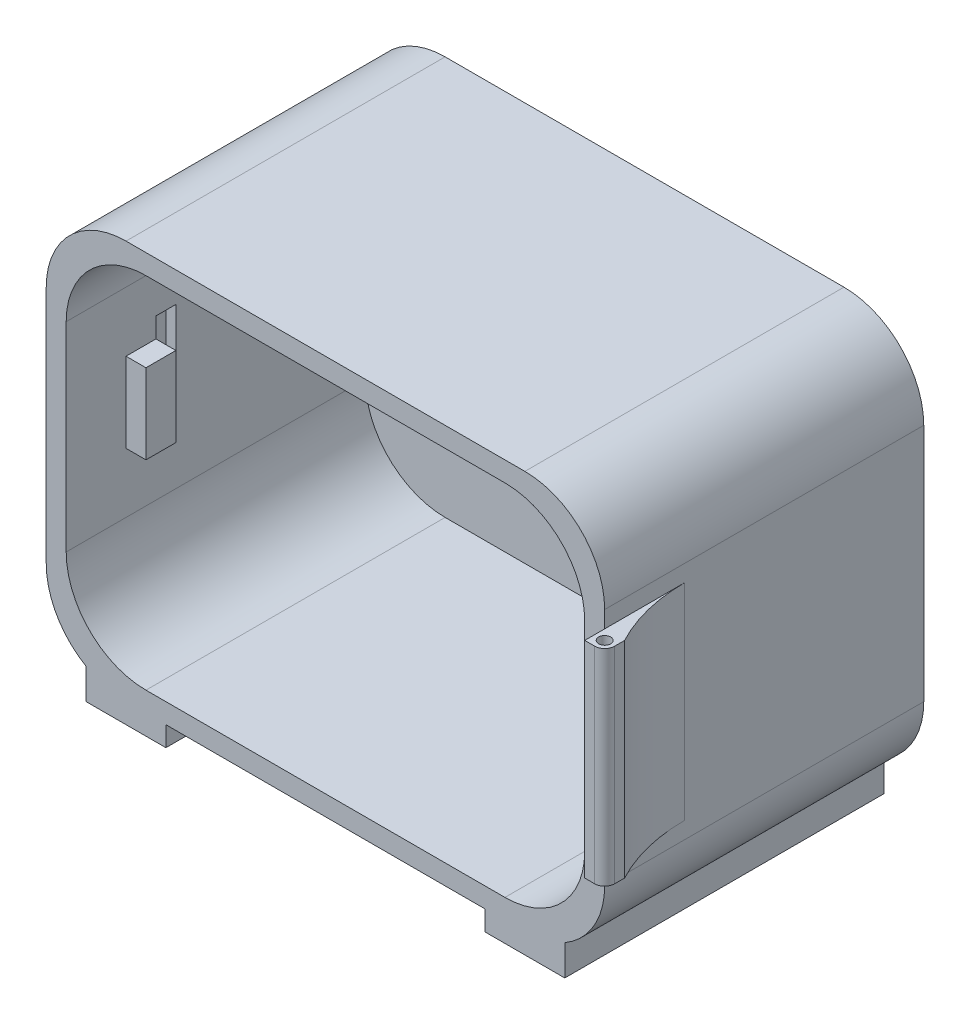
from build123d import *

# Parameters (mm, degrees)
BOSS_EXTRUDE1_DEPTH             = 95.25
BOSS_EXTRUDE2_DEPTH             = 6.35
SKETCH4_W                       = 25.4
SKETCH4_H                       = 101.6
BOSS_EXTRUDE3_DEPTH             = 6.35
BOSS_EXTRUDE3_DIRECTION_2_REACH = 187.35
BOSS_EXTRUDE5_DEPTH             = 32.766
BOSS_EXTRUDE5_DEPTH_BACK        = 32.766
SKETCH5_R                       = 1.905
FILLET1_R                       = 3.175
SKETCH8_W                       = 6.35
SKETCH8_H                       = 38.1
CUT_EXTRUDE1_DEPTH              = 3.175
SKETCH10_W                      = 9.525
SKETCH10_H                      = 25.4
BOSS_EXTRUDE6_DEPTH             = 6.35
SKETCH11_R                      = 44.824096384
CUT_EXTRUDE4_DEPTH              = 1.5875
SKETCH12_W                      = 1.13974359
SKETCH12_H                      = 13.025641026
SKETCH12_W_2                    = 4.884615385
SKETCH12_H_2                    = 1.302564103
CUT_EXTRUDE5_DEPTH              = 1.5875


with BuildPart() as part:
    # Sketch1 → Boss-Extrude1 (new body)
    with BuildSketch(Plane.XY):
        with BuildLine():
            Line((-63.5, 63.5), (63.5, 63.5))
            ThreePointArc((63.5, 63.5), (81.460512242, 56.060512242), (88.9, 38.1))
            Line((88.9, 38.1), (88.9, -38.1))
            ThreePointArc((88.9, -38.1), (81.460512242, -56.060512242), (63.5, -63.5))
            Line((63.5, -63.5), (-63.5, -63.5))
            ThreePointArc((-63.5, -63.5), (-81.460512242, -56.060512242), (-88.9, -38.1))
            Line((-88.9, -38.1), (-88.9, 38.1))
            ThreePointArc((-88.9, 38.1), (-81.460512242, 56.060512242), (-63.5, 63.5))
        make_face()
        with BuildLine():
            Line((-82.55, 31.75), (-82.55, -31.75))
            ThreePointArc((-82.55, -31.75), (-75.110512242, -49.710512242), (-57.15, -57.15))
            Line((-57.15, -57.15), (57.15, -57.15))
            ThreePointArc((57.15, -57.15), (75.110512242, -49.710512242), (82.55, -31.75))
            Line((82.55, -31.75), (82.55, 31.75))
            ThreePointArc((82.55, 31.75), (75.110512242, 49.710512242), (57.15, 57.15))
            Line((57.15, 57.15), (-57.15, 57.15))
            ThreePointArc((-57.15, 57.15), (-75.110512242, 49.710512242), (-82.55, 31.75))
        make_face(mode=Mode.SUBTRACT)
    extrude(amount=-BOSS_EXTRUDE1_DEPTH)

    # Sketch2 → Boss-Extrude2 (add)
    with BuildSketch(Plane(origin=(0, 0, -95.25), x_dir=(-1, 0, 0), z_dir=(0, 0, -1))):
        with BuildLine():
            Line((-63.5, 63.5), (63.5, 63.5))
            ThreePointArc((63.5, 63.5), (81.460512242, 56.060512242), (88.9, 38.1))
            Line((88.9, 38.1), (88.9, -38.1))
            ThreePointArc((88.9, -38.1), (81.460512242, -56.060512242), (63.5, -63.5))
            Line((63.5, -63.5), (-63.5, -63.5))
            ThreePointArc((-63.5, -63.5), (-81.460512242, -56.060512242), (-88.9, -38.1))
            Line((-88.9, -38.1), (-88.9, 38.1))
            ThreePointArc((-88.9, 38.1), (-81.460512242, 56.060512242), (-63.5, 63.5))
        make_face()
    extrude(amount=BOSS_EXTRUDE2_DEPTH)

    # Sketch4 → Boss-Extrude3 (add)
    with BuildSketch(Plane.XZ.offset(63.5)):
        with Locations((-63.5, -50.8)):
            Rectangle(SKETCH4_W, SKETCH4_H)
        with Locations((63.5, -50.8)):
            Rectangle(SKETCH4_W, SKETCH4_H)
    extrude(amount=BOSS_EXTRUDE3_DEPTH)

    # Sketch4 → Boss-Extrude3 direction 2 (add, up to next)
    with BuildSketch(Plane.XZ.offset(63.5), mode=Mode.PRIVATE) as boss_extrude3_direction_2_sk1:
        with Locations((-63.5, -50.8)):
            Rectangle(SKETCH4_W, SKETCH4_H)
    boss_extrude3_direction_2_tool1 = extrude(boss_extrude3_direction_2_sk1.sketch, amount=-BOSS_EXTRUDE3_DIRECTION_2_REACH, mode=Mode.PRIVATE) - part.part
    # Sketch4 → Boss-Extrude3 direction 2 (add, up to next)
    with BuildSketch(Plane.XZ.offset(63.5), mode=Mode.PRIVATE) as boss_extrude3_direction_2_sk2:
        with Locations((63.5, -50.8)):
            Rectangle(SKETCH4_W, SKETCH4_H)
    boss_extrude3_direction_2_tool2 = extrude(boss_extrude3_direction_2_sk2.sketch, amount=-BOSS_EXTRUDE3_DIRECTION_2_REACH, mode=Mode.PRIVATE) - part.part
    add(boss_extrude3_direction_2_tool1.solids().sort_by_distance((-63.5, -63.5, -50.8))[0])
    add(boss_extrude3_direction_2_tool2.solids().sort_by_distance((63.5, -63.5, -50.8))[0])

    # Sketch5 → Boss-Extrude5 (add, two sides: drawn at the far end of the back side and taken through both)
    with BuildSketch(Plane(origin=(0, 0, 0), x_dir=(1, 0, 0), z_dir=(0, 1, 0)).offset(-BOSS_EXTRUDE5_DEPTH_BACK)):
        with BuildLine():
            Line((88.9, 25.4), (88.9, 0))
            Line((88.9, 0), (88.9, -6.35))
            Line((88.9, -6.35), (95.25, -6.35))
            Line((95.25, -6.35), (95.25, 0))
            ThreePointArc((95.25, 0), (90.511558555, 12.309139639), (88.9, 25.4))
        make_face()
        with Locations(Location((92.075, -3.175, 0), (0, 0, 270))):
            Circle(SKETCH5_R, mode=Mode.SUBTRACT)
    extrude(amount=BOSS_EXTRUDE5_DEPTH + BOSS_EXTRUDE5_DEPTH_BACK)

    # Fillet1
    fillet1_edges = [part.edges().sort_by_distance(p)[0] for p in [
        (95.25, 0, 6.35),
    ]]
    fillet(fillet1_edges, radius=FILLET1_R)

    # Sketch8 → Cut-Extrude1 (cut)
    with BuildSketch(Plane(origin=(-82.55, 0, 0), x_dir=(0, 0, -1), z_dir=(1, 0, 0))):
        with Locations((31.75, 0)):
            Rectangle(SKETCH8_W, SKETCH8_H)
    extrude(amount=-CUT_EXTRUDE1_DEPTH, mode=Mode.SUBTRACT)

    # Sketch10 → Boss-Extrude6 (add)
    with BuildSketch(Plane(origin=(-82.55, 0, 0), x_dir=(0, 0, -1), z_dir=(1, 0, 0))):
        with Locations((23.8125, 0)):
            Rectangle(SKETCH10_W, SKETCH10_H)
    extrude(amount=BOSS_EXTRUDE6_DEPTH)

    # Sketch11 → Cut-Extrude4 (cut)
    # profile 1 of 2: a face of its own
    with BuildSketch(Plane(origin=(0, 0, -101.6), x_dir=(-1, 0, 0), z_dir=(0, 0, -1))):
        with Locations((0, 3.175)):
            Circle(SKETCH11_R)
        with BuildLine():
            Line((-8.558023622, 38.277554278), (9.414722671, 38.277554278))
            Line((9.414722671, 38.277554278), (12.376141094, 30.516595652))
            Line((12.376141094, 30.516595652), (6.555422124, 30.516595652))
            ThreePointArc((6.555422124, 30.516595652), (-1.070912861, 28.84594719), (6.555422124, 27.175298727))
            Line((6.555422124, 27.175298727), (13.309498487, 27.175298727))
            Line((13.309498487, 27.175298727), (31.249567059, -24.733260338))
            Line((31.249567059, -24.733260338), (24.338229167, -24.733260338))
            Line((24.338229167, -24.733260338), (24.338229167, -18.851270642))
            ThreePointArc((24.338229167, -18.851270642), (22.794206871, -11.23122082), (21.250184576, -18.851270642))
            Line((21.250184576, -18.851270642), (21.250184576, -24.733260338))
            Line((21.250184576, -24.733260338), (16.103443592, -24.733260338))
            Line((16.103443592, -24.733260338), (16.103443592, -18.851270642))
            ThreePointArc((16.103443592, -18.851270642), (14.239792343, -11.126064356), (12.376141094, -18.851270642))
            Line((12.376141094, -18.851270642), (12.376141094, -24.733260338))
            Line((12.376141094, -24.733260338), (10.515553381, -24.733260338))
            Line((10.515553381, -24.733260338), (8.456856988, -17.527822961))
            Line((8.456856988, -17.527822961), (-7.424515191, -17.527822961))
            Line((-7.424515191, -17.527822961), (-9.630261327, -24.733260338))
            Line((-9.630261327, -24.733260338), (-30.070175519, -24.733260338))
            Line((-30.070175519, -24.733260338), (-27.864429383, -17.527822961))
            Line((-27.864429383, -17.527822961), (-20.953091491, -17.527822961))
            ThreePointArc((-20.953091491, -17.527822961), (-12.798886715, -15.836750923), (-20.953091491, -14.145678885))
            Line((-20.953091491, -14.145678885), (-26.540981702, -14.145678885))
            Line((-26.540981702, -14.145678885), (-8.558023622, 38.277554278))
        make_face(mode=Mode.SUBTRACT)
    # profile 2 of 2: a face of its own
    with BuildSketch(Plane(origin=(0, 0, -101.6), x_dir=(-1, 0, 0), z_dir=(0, 0, -1))):
        Polygon((0.754840192, 15.029545848), (-4.852280703, -6.689071297), (6.018431459, -6.689071297), align=None)
    extrude(amount=-CUT_EXTRUDE4_DEPTH, mode=Mode.SUBTRACT)

    # Sketch12 → Cut-Extrude5 (cut)
    # profile 1 of 11: a face of its own
    with BuildSketch(Plane(origin=(0, 0, -101.6), x_dir=(-1, 0, 0), z_dir=(0, 0, -1))):
        with BuildLine():
            Line((51.288461538, -47.869230769), (52.428205128, -47.869230769))
            Line((52.428205128, -47.869230769), (52.428205128, -55.234314904))
            add(Edge.make_bspline(
                [(52.428205128, -55.234314904), (52.427199859, -55.391205604), (52.425259449, -55.694042448), (52.411285924, -56.131932206), (52.381819467, -56.536394859), (52.348405109, -56.909275054), (52.300338453, -57.248844425), (52.241641349, -57.556116225), (52.175471884, -57.831385323), (52.117341381, -58.000929746), (52.08984375, -58.081129808)],
                knots=[0, 0, 0, 0, 1.307562039, 2.523909702, 3.650326591, 4.686913197, 5.643429486, 6.506965704, 7.293745905, 8, 8, 8, 8], degree=3))
            add(Edge.make_bspline(
                [(52.08984375, -58.081129808), (52.049242798, -58.18537838), (51.969254836, -58.39075856), (51.819446966, -58.681894524), (51.651683945, -58.956019996), (51.460070878, -59.211607319), (51.245474246, -59.44737343), (51.012949975, -59.668440513), (50.757969566, -59.870131635), (50.48067881, -60.048966857), (50.187469798, -60.210028454), (49.878511085, -60.349534569), (49.555544866, -60.471043973), (49.215537231, -60.562058689), (48.863818951, -60.640924675), (48.496253987, -60.692249677), (48.114989839, -60.727182146), (47.855745174, -60.730412419), (47.72421875, -60.732051282)],
                knots=[0, 0, 0, 0, 0.981931301, 1.934503488, 2.87077864, 3.801706999, 4.735015492, 5.667491629, 6.616593066, 7.585388521, 8.561939025, 9.551802639, 10.560317337, 11.588439944, 12.640189604, 13.723962949, 14.845264515, 16, 16, 16, 16], degree=3))
            add(Edge.make_bspline(
                [(47.72421875, -60.732051282), (47.532322713, -60.728943462), (47.157498196, -60.722873055), (46.611017223, -60.652148877), (46.092005525, -60.552165866), (45.607321067, -60.400834743), (45.160026716, -60.21564338), (44.753177225, -60.003027408), (44.39042492, -59.759226202), (44.063404735, -59.481638307), (43.768250965, -59.151570091), (43.490566228, -58.762591428), (43.223282238, -58.308777287), (43.066641753, -57.975700871), (42.984615385, -57.801282051)],
                knots=[0, 0, 0, 0, 1.157897085, 2.2616841, 3.32207898, 4.345638746, 5.321241055, 6.241986252, 7.112515963, 7.955008012, 8.825025602, 9.77857164, 10.836726669, 12, 12, 12, 12], degree=3))
            Line((42.984615385, -57.801282051), (44.124358974, -57.801282051))
            add(Edge.make_bspline(
                [(44.124358974, -57.801282051), (44.216024705, -57.946809086), (44.395219921, -58.231296519), (44.730312981, -58.599644257), (45.097547365, -58.914435037), (45.509316501, -59.168111274), (45.967333711, -59.359372517), (46.471874544, -59.495717165), (47.0270446, -59.577346476), (47.413553549, -59.5871846), (47.614823718, -59.592307692)],
                knots=[0, 0, 0, 0, 0.997731894, 1.950442991, 2.880492273, 3.800895997, 4.748200782, 5.754801363, 6.83083817, 8, 8, 8, 8], degree=3))
            add(Edge.make_bspline(
                [(47.614823718, -59.592307692), (47.813549291, -59.587118295), (48.196672306, -59.577113657), (48.747602548, -59.495680734), (49.25050418, -59.359342846), (49.702479765, -59.168449559), (50.098196411, -58.934586655), (50.439325637, -58.673329242), (50.715622033, -58.378758174), (50.90145194, -58.107407049), (51.016966124, -57.865656635), (51.090525383, -57.657548644), (51.150302358, -57.422225345), (51.200303483, -57.160475674), (51.241563654, -56.871925661), (51.267699828, -56.55591554), (51.286589487, -56.213163505), (51.287823092, -55.975516975), (51.288461538, -55.852524038)],
                knots=[0, 0, 0, 0, 1.570740765, 3.028230971, 4.391408896, 5.680370741, 6.894727393, 8.017376726, 9.065722033, 10.075533815, 10.603371122, 11.180248986, 11.817768598, 12.521299649, 13.286540596, 14.121245857, 15.027658897, 16, 16, 16, 16], degree=3))
            Line((51.288461538, -55.852524038), (51.288461538, -55.371694712))
            add(Edge.make_bspline(
                [(51.288461538, -55.371694712), (51.172778627, -55.509369251), (50.94344763, -55.782296676), (50.547398758, -56.139934615), (50.114811664, -56.447950002), (49.64642281, -56.70056619), (49.153705474, -56.902610217), (48.641996238, -57.043917532), (48.115882209, -57.135212026), (47.759367265, -57.145035716), (47.579206731, -57.15)],
                knots=[0, 0, 0, 0, 1.012485704, 2.007162095, 2.997754123, 3.998611389, 4.999708251, 5.992315798, 6.98544096, 8, 8, 8, 8], degree=3))
            add(Edge.make_bspline(
                [(47.579206731, -57.15), (47.473120839, -57.14813119), (47.262204473, -57.144415684), (46.948860104, -57.111908121), (46.640139657, -57.064741256), (46.336763132, -56.995502891), (46.038292765, -56.906632912), (45.745221788, -56.795537889), (45.455177277, -56.66993446), (45.173431413, -56.52198743), (44.90279031, -56.357387059), (44.645295324, -56.179083085), (44.402295197, -55.988008724), (44.176102792, -55.782279829), (43.967014813, -55.562194153), (43.772219063, -55.330097832), (43.594936689, -55.082749942), (43.43152982, -54.824660696), (43.289806709, -54.554111058), (43.165403416, -54.276967683), (43.057237861, -53.993823162), (42.971003403, -53.703729535), (42.905140792, -53.406869688), (42.856117969, -53.103729945), (42.828312474, -52.793376824), (42.823976607, -52.584293643), (42.821794872, -52.479086538)],
                knots=[0, 0, 0, 0, 1.028754217, 2.045334182, 3.052854819, 4.056607503, 5.061168794, 6.071104265, 7.095078842, 8.125279047, 9.155117945, 10.165957491, 11.161587969, 12.151493252, 13.128948131, 14.104219989, 15.088194871, 16.07871515, 17.064853787, 18.047899887, 19.02414258, 20.002704429, 20.980574569, 21.971845993, 22.979467364, 24, 24, 24, 24], degree=3))
            add(Edge.make_bspline(
                [(42.821794872, -52.479086538), (42.823678704, -52.373846733), (42.827439071, -52.163774731), (42.859918339, -51.852155247), (42.906248626, -51.544708439), (42.97957396, -51.244603296), (43.06782997, -50.948422054), (43.177135505, -50.658352398), (43.30855786, -50.374305979), (43.457364666, -50.096072451), (43.624584088, -49.827385391), (43.807944804, -49.572200133), (44.007668176, -49.332394481), (44.220998841, -49.105549178), (44.450541606, -48.893852903), (44.696177721, -48.697819459), (44.955485887, -48.514162849), (45.229269765, -48.346844569), (45.513304861, -48.198863274), (45.800375, -48.063834708), (46.094282881, -47.956668046), (46.389548953, -47.862241372), (46.691373215, -47.79534795), (46.9960549, -47.743741529), (47.304637097, -47.71230097), (47.511294745, -47.708376362), (47.614823718, -47.706410256)],
                knots=[0, 0, 0, 0, 1.008818848, 2.013730394, 3.001654427, 3.987803273, 4.973046549, 5.963777569, 6.957074694, 7.972068341, 8.987420212, 9.989399531, 10.982630087, 11.977756091, 12.973280677, 13.973972381, 14.989194003, 16.018387222, 17.047741039, 18.059210846, 19.057554164, 20.045176975, 21.029480261, 22.018708529, 23.007435371, 24, 24, 24, 24], degree=3))
            add(Edge.make_bspline(
                [(47.614823718, -47.706410256), (47.785551411, -47.711333042), (48.122686145, -47.721054032), (48.618824354, -47.797330759), (49.097586196, -47.918938751), (49.561673282, -48.093166896), (50.014866073, -48.331019892), (50.455670936, -48.644321446), (50.885363223, -49.035881822), (51.150531351, -49.336156501), (51.288461538, -49.492347756)],
                knots=[0, 0, 0, 0, 0.96728863, 1.910097829, 2.838038873, 3.762875196, 4.71315279, 5.730631239, 6.819562287, 8, 8, 8, 8], degree=3))
            Line((51.288461538, -49.492347756), (51.288461538, -47.869230769))
        make_face()
        with BuildLine():
            add(Edge.make_bspline(
                [(47.706410256, -48.846153846), (47.539747417, -48.851818284), (47.209790334, -48.863032669), (46.726144062, -48.958771486), (46.259230618, -49.108798037), (45.817976636, -49.323401242), (45.404656551, -49.585000334), (45.037899346, -49.901920806), (44.717115793, -50.263857006), (44.44576056, -50.667536474), (44.229746744, -51.103045873), (44.076826336, -51.562099108), (43.97794768, -52.037278654), (43.9670342, -52.361573528), (43.961538462, -52.524879808)],
                knots=[0, 0, 0, 0, 1.026226791, 2.031711442, 3.026614839, 4.04107745, 5.047145931, 6.032893242, 7.017642609, 8.019221815, 9.021877557, 10.003543541, 10.994637589, 12, 12, 12, 12], degree=3))
            add(Edge.make_bspline(
                [(43.961538462, -52.524879808), (43.964171922, -52.648009111), (43.969351169, -52.890168444), (44.019148151, -53.24554309), (44.099633367, -53.584017371), (44.213705516, -53.905611758), (44.355048152, -54.212170871), (44.532820469, -54.501582952), (44.742011138, -54.774105742), (44.980982821, -55.027723588), (45.244331407, -55.258721959), (45.529969644, -55.461697135), (45.837510122, -55.627706894), (46.159389119, -55.771183647), (46.503416719, -55.875973408), (46.864637689, -55.955942692), (47.245607559, -56.001694469), (47.505310727, -56.007365193), (47.637720353, -56.01025641)],
                knots=[0, 0, 0, 0, 1.039728707, 2.044842319, 3.024901384, 3.974314358, 4.923051295, 5.871625912, 6.837440708, 7.820715446, 8.810779094, 9.792721783, 10.773906224, 11.758876063, 12.764959493, 13.806266761, 14.881525401, 16, 16, 16, 16], degree=3))
            add(Edge.make_bspline(
                [(47.637720353, -56.01025641), (47.771845989, -56.007471086), (48.034127251, -56.002024414), (48.417198935, -55.955203148), (48.780174878, -55.87964912), (49.122722262, -55.772377571), (49.446134443, -55.635501504), (49.74677833, -55.462285778), (50.031100299, -55.265020553), (50.290022128, -55.03492553), (50.524152671, -54.781342834), (50.728190025, -54.5054085), (50.902051026, -54.211274617), (51.046024285, -53.898974339), (51.155938083, -53.566080658), (51.229666681, -53.213425767), (51.281216871, -52.8426992), (51.286009941, -52.588667936), (51.288461538, -52.458733974)],
                knots=[0, 0, 0, 0, 1.121943988, 2.193949579, 3.223793937, 4.220241907, 5.192961521, 6.155822191, 7.11847367, 8.083710714, 9.04790392, 10.001595906, 10.949595423, 11.902125208, 12.873731292, 13.87582262, 14.913508608, 16, 16, 16, 16], degree=3))
            add(Edge.make_bspline(
                [(51.288461538, -52.458733974), (51.28360082, -52.289577761), (51.274104683, -51.959105963), (51.184489283, -51.477569977), (51.039998806, -51.024837932), (50.837354876, -50.602341676), (50.583420159, -50.214557882), (50.277564793, -49.868668503), (49.925063482, -49.564228252), (49.526929004, -49.310597664), (49.098585417, -49.105708802), (48.650379935, -48.951996086), (48.182977974, -48.864931), (47.866180431, -48.85244892), (47.706410256, -48.846153846)],
                knots=[0, 0, 0, 0, 1.070913519, 2.092188694, 3.091357305, 4.074328408, 5.051968682, 6.018948707, 6.99050112, 7.9935919, 9.000589572, 9.992915277, 10.987769056, 12, 12, 12, 12], degree=3))
        make_face(mode=Mode.SUBTRACT)
    # profile 2 of 11: a face of its own
    with BuildSketch(Plane(origin=(0, 0, -101.6), x_dir=(-1, 0, 0), z_dir=(0, 0, -1))):
        with BuildLine():
            Line((37.611538462, -47.869230769), (38.751282051, -47.869230769))
            Line((38.751282051, -47.869230769), (38.751282051, -49.235396635))
            add(Edge.make_bspline(
                [(38.751282051, -49.235396635), (38.835424119, -49.108194058), (38.996345169, -48.864920117), (39.263817798, -48.543177225), (39.537787029, -48.276785485), (39.819564423, -48.064501288), (40.1112221, -47.905522257), (40.406359039, -47.789070387), (40.709618601, -47.720209843), (40.913406155, -47.71101628), (41.015504808, -47.706410256)],
                knots=[0, 0, 0, 0, 1.2804753, 2.448899062, 3.506932113, 4.484331642, 5.4025378, 6.288909075, 7.142734305, 8, 8, 8, 8], degree=3))
            add(Edge.make_bspline(
                [(41.015504808, -47.706410256), (41.094703192, -47.710730167), (41.257659016, -47.719618664), (41.504338699, -47.782069371), (41.758496367, -47.881775338), (41.922298744, -47.975538432), (42.007692308, -48.024419071)],
                knots=[0, 0, 0, 0, 0.901110191, 1.854092781, 2.881294221, 4, 4, 4, 4], degree=3))
            Line((42.007692308, -48.024419071), (41.381850962, -49.011518429))
            add(Edge.make_bspline(
                [(41.381850962, -49.011518429), (41.327026799, -48.987060892), (41.222960044, -48.940635805), (41.070724903, -48.88569194), (40.93036691, -48.853339902), (40.840945998, -48.848438728), (40.799258814, -48.846153846)],
                knots=[0, 0, 0, 0, 1.180555205, 2.24091978, 3.179933427, 4, 4, 4, 4], degree=3))
            add(Edge.make_bspline(
                [(40.799258814, -48.846153846), (40.70779801, -48.852249982), (40.52124448, -48.864684331), (40.247343582, -48.962433719), (39.981560865, -49.120368162), (39.770480833, -49.295523339), (39.607041802, -49.464425347), (39.490418698, -49.61192098), (39.383438444, -49.7773063), (39.281220787, -49.957754009), (39.188088806, -50.156345165), (39.101167577, -50.371095682), (39.022576846, -50.602254292), (38.977763103, -50.763299437), (38.954807692, -50.845793269)],
                knots=[0, 0, 0, 0, 1.125678352, 2.296057538, 3.5422874, 4.923748041, 5.663163013, 6.437101912, 7.23742474, 8.08941207, 8.991984279, 9.93940061, 10.944477711, 12, 12, 12, 12], degree=3))
            add(Edge.make_bspline(
                [(38.954807692, -50.845793269), (38.937635865, -50.919370442), (38.899601572, -51.082338288), (38.862620849, -51.355745792), (38.826082884, -51.678774497), (38.800332297, -52.052323563), (38.776463402, -52.475460145), (38.763001103, -52.948828862), (38.751741136, -53.472915593), (38.751439722, -53.839308246), (38.751282051, -54.030969551)],
                knots=[0, 0, 0, 0, 0.566838948, 1.255505196, 2.06880316, 3.007127437, 4.065329342, 5.249902469, 6.561414163, 8, 8, 8, 8], degree=3))
            Line((38.751282051, -54.030969551), (38.751282051, -57.15))
            Line((38.751282051, -57.15), (37.611538462, -57.15))
            Line((37.611538462, -57.15), (37.611538462, -47.869230769))
        make_face()
    # profile 3 of 11: a face of its own
    with BuildSketch(Plane(origin=(0, 0, -101.6), x_dir=(-1, 0, 0), z_dir=(0, 0, -1))):
        with BuildLine():
            add(Edge.make_bspline(
                [(30.859575321, -47.706410256), (31.033715082, -47.710118261), (31.375160597, -47.717388753), (31.875206354, -47.795094486), (32.352527276, -47.913920636), (32.808951459, -48.078191733), (33.238633445, -48.298380525), (33.647831959, -48.56112281), (34.035425106, -48.872391078), (34.267737241, -49.113176069), (34.385657051, -49.235396635)],
                knots=[0, 0, 0, 0, 1.054011418, 2.066658804, 3.057071809, 4.030435133, 4.997543892, 5.974964718, 6.972108034, 8, 8, 8, 8], degree=3))
            add(Edge.make_bspline(
                [(34.385657051, -49.235396635), (34.48719157, -49.352287383), (34.688295636, -49.583806722), (34.946162673, -49.959202803), (35.168309477, -50.347968311), (35.346337935, -50.755265754), (35.486709307, -51.17753956), (35.586370547, -51.616241144), (35.645650283, -52.070401661), (35.653643906, -52.378844159), (35.657692308, -52.53505609)],
                knots=[0, 0, 0, 0, 1.025258237, 2.030674902, 3.01204498, 3.988269485, 4.97094183, 5.956517959, 6.965070386, 8, 8, 8, 8], degree=3))
            add(Edge.make_bspline(
                [(35.657692308, -52.53505609), (35.654131455, -52.692173442), (35.647095044, -53.002644657), (35.580533922, -53.459914927), (35.477006839, -53.90330757), (35.328845598, -54.330966258), (35.138860458, -54.744198232), (34.907028535, -55.141198597), (34.631722953, -55.522750623), (34.319651307, -55.885614436), (33.974748785, -56.22004613), (33.600584476, -56.511522994), (33.204511268, -56.761246811), (32.781262529, -56.962401804), (32.334703362, -57.121005574), (31.863870572, -57.232402777), (31.369495603, -57.299755172), (31.031939685, -57.308404138), (30.859575321, -57.312820513)],
                knots=[0, 0, 0, 0, 0.998656419, 1.973391657, 2.932242238, 3.890759089, 4.846373663, 5.82037756, 6.809684879, 7.83454468, 8.860553229, 9.859544525, 10.845671541, 11.83227036, 12.833544569, 13.85385346, 14.904124723, 16, 16, 16, 16], degree=3))
            add(Edge.make_bspline(
                [(30.859575321, -57.312820513), (30.686366481, -57.308389315), (30.347128219, -57.299710591), (29.851008227, -57.23266445), (29.37933161, -57.121056914), (28.932187838, -56.961880583), (28.507119393, -56.761240381), (28.108751247, -56.512277965), (27.734282983, -56.219959687), (27.389307496, -55.885637858), (27.077255414, -55.522744588), (26.801944784, -55.141200163), (26.570114172, -54.744197824), (26.380128689, -54.330966367), (26.231967539, -53.90330754), (26.128440432, -53.459914935), (26.061879316, -53.002644655), (26.054842904, -52.692173441), (26.051282051, -52.53505609)],
                knots=[0, 0, 0, 0, 1.099876186, 2.154163076, 3.173186993, 4.173200201, 5.163417411, 6.152872554, 7.150605724, 8.17532212, 9.198891216, 10.186952605, 11.159729845, 12.11414092, 13.071450619, 14.029093627, 15.002601286, 16, 16, 16, 16], degree=3))
            add(Edge.make_bspline(
                [(26.051282051, -52.53505609), (26.055358063, -52.379693195), (26.063427866, -52.072101363), (26.122647999, -51.6187946), (26.221920475, -51.180835503), (26.362460114, -50.760191633), (26.542129521, -50.35467905), (26.761154766, -49.964952949), (27.021652204, -49.591254359), (27.221956428, -49.36003424), (27.323317308, -49.243028846)],
                knots=[0, 0, 0, 0, 1.031353054, 2.041901799, 3.029428768, 4.008703097, 4.981709435, 5.96992636, 6.972712378, 8, 8, 8, 8], degree=3))
            add(Edge.make_bspline(
                [(27.323317308, -49.243028846), (27.441059338, -49.119748352), (27.672619758, -48.877295569), (28.062142285, -48.566934696), (28.47033415, -48.298724942), (28.904764596, -48.082911246), (29.360813823, -47.912954339), (29.840580789, -47.794788041), (30.342323374, -47.717668724), (30.685439713, -47.710200479), (30.859575321, -47.706410256)],
                knots=[0, 0, 0, 0, 1.027980169, 2.021703884, 2.998553061, 3.971491411, 4.943284454, 5.930300938, 6.949603206, 8, 8, 8, 8], degree=3))
        make_face()
        with BuildLine():
            add(Edge.make_bspline(
                [(30.854487179, -48.846153846), (30.731342133, -48.849653936), (30.488231009, -48.856563761), (30.130382801, -48.909119644), (29.785885671, -48.992386302), (29.454086037, -49.110692449), (29.136102811, -49.26345131), (28.831631551, -49.451078789), (28.539776698, -49.671089802), (28.266247496, -49.923140068), (28.015214535, -50.19847242), (27.795765877, -50.491836465), (27.609166206, -50.798473778), (27.453717629, -51.11870323), (27.337940118, -51.455769989), (27.25385515, -51.805856851), (27.201348849, -52.169677077), (27.19450399, -52.4170042), (27.191025641, -52.542688301)],
                knots=[0, 0, 0, 0, 1.021534396, 2.016698045, 2.994645724, 3.958388632, 4.93408049, 5.916473867, 6.921342795, 7.962252576, 8.998418191, 10.008913653, 10.997312074, 11.973003931, 12.956656626, 13.948281152, 14.957379055, 16, 16, 16, 16], degree=3))
            add(Edge.make_bspline(
                [(27.191025641, -52.542688301), (27.196856115, -52.705074228), (27.208428517, -53.027379928), (27.302536375, -53.502037431), (27.45996659, -53.957720151), (27.672554719, -54.391756752), (27.938914427, -54.793339018), (28.252738926, -55.151375547), (28.610660125, -55.460478348), (29.008411425, -55.716948845), (29.437868522, -55.92072853), (29.89237003, -56.065141956), (30.36640912, -56.15901924), (30.69037063, -56.168350018), (30.854487179, -56.173076923)],
                knots=[0, 0, 0, 0, 1.016792936, 2.018143844, 3.017858371, 4.030088057, 5.03801393, 6.028138512, 7.003788237, 7.991172063, 8.984598303, 9.972568034, 10.972917682, 12, 12, 12, 12], degree=3))
            add(Edge.make_bspline(
                [(30.854487179, -56.173076923), (31.01859429, -56.168322478), (31.342537166, -56.158937334), (31.815917608, -56.06561476), (32.269176877, -55.920095762), (32.698187912, -55.717178029), (33.095758159, -55.45950441), (33.456253542, -55.153120985), (33.767398502, -54.792390724), (34.033494726, -54.391224834), (34.249564335, -53.958393042), (34.406257667, -53.501953328), (34.500591765, -53.027401347), (34.512133629, -52.705081404), (34.517948718, -52.542688301)],
                knots=[0, 0, 0, 0, 1.02726834, 2.027799167, 3.010890988, 4.004497153, 4.992059811, 5.971914811, 6.958719428, 7.966827853, 8.981595046, 9.981490638, 10.983022906, 12, 12, 12, 12], degree=3))
            add(Edge.make_bspline(
                [(34.517948718, -52.542688301), (34.514471567, -52.417003449), (34.507629064, -52.169674847), (34.455105622, -51.805865373), (34.371084092, -51.455738722), (34.255072795, -51.118818596), (34.100299659, -50.797644652), (33.910101582, -50.492736785), (33.691549004, -50.197456175), (33.437486879, -49.924030107), (33.164243194, -49.670991546), (32.872270055, -49.450993476), (32.568250276, -49.264275915), (32.251190847, -49.109385842), (31.919348673, -48.993462636), (31.575334233, -48.908638858), (31.219012837, -48.856785859), (30.97677288, -48.849720517), (30.854487179, -48.846153846)],
                knots=[0, 0, 0, 0, 1.042956736, 2.052379634, 3.044323526, 4.02829302, 5.004299113, 5.996692471, 7.007513377, 8.048758398, 9.090003419, 10.095195979, 11.07790575, 12.047570684, 13.018257071, 13.989683339, 14.985167495, 16, 16, 16, 16], degree=3))
        make_face(mode=Mode.SUBTRACT)
    # profile 4 of 11: a face of its own
    with BuildSketch(Plane(origin=(0, 0, -101.6), x_dir=(-1, 0, 0), z_dir=(0, 0, -1))):
        with BuildLine():
            add(Edge.make_bspline(
                [(22.876282051, -55.196153846), (22.947003678, -55.200356337), (23.08564516, -55.208594828), (23.286084283, -55.265115901), (23.467493477, -55.365477327), (23.629081908, -55.499236551), (23.76227398, -55.661417957), (23.866212057, -55.841380255), (23.922240775, -56.043497462), (23.930419255, -56.182942283), (23.934615385, -56.254487179)],
                knots=[0, 0, 0, 0, 1.020151414, 1.999887582, 2.974338812, 3.990962822, 5.007586832, 5.987933904, 6.967670073, 8, 8, 8, 8], degree=3))
            add(Edge.make_bspline(
                [(23.934615385, -56.254487179), (23.930277062, -56.324312976), (23.921721953, -56.462008421), (23.866340489, -56.662601157), (23.76148185, -56.842675925), (23.63000059, -57.007057969), (23.467453531, -57.141100557), (23.285655403, -57.240608122), (23.086115694, -57.301176163), (22.947082178, -57.308891584), (22.876282051, -57.312820513)],
                knots=[0, 0, 0, 0, 1.009421747, 1.99056486, 2.972319754, 3.999869655, 5.017953583, 5.993804169, 6.978383603, 8, 8, 8, 8], degree=3))
            add(Edge.make_bspline(
                [(22.876282051, -57.312820513), (22.805430908, -57.309033746), (22.667110917, -57.301640985), (22.468316023, -57.239364517), (22.285410737, -57.142033675), (22.122895326, -57.006808032), (21.990312872, -56.843521797), (21.890072197, -56.661360993), (21.829873657, -56.462582635), (21.821956576, -56.324426073), (21.817948718, -56.254487179)],
                knots=[0, 0, 0, 0, 1.022052826, 1.995314843, 2.982371812, 4.00089066, 5.028879526, 6.005146991, 6.990147033, 8, 8, 8, 8], degree=3))
            add(Edge.make_bspline(
                [(21.817948718, -56.254487179), (21.821802621, -56.182825145), (21.829326894, -56.042913817), (21.890198575, -55.842619912), (21.989535115, -55.660580147), (22.123811834, -55.499483985), (22.285371422, -55.364547201), (22.467874795, -55.266340666), (22.667589699, -55.208136885), (22.805511475, -55.200217467), (22.876282051, -55.196153846)],
                knots=[0, 0, 0, 0, 1.032775665, 2.016367738, 2.991239715, 4.008302682, 5.025365648, 6.011011707, 6.979408107, 8, 8, 8, 8], degree=3))
        make_face()
    # profile 5 of 11: a face of its own
    with BuildSketch(Plane(origin=(0, 0, -101.6), x_dir=(-1, 0, 0), z_dir=(0, 0, -1))):
        with BuildLine():
            Line((9.606410256, -57.15), (9.606410256, -44.124358974))
            Line((9.606410256, -44.124358974), (10.746153846, -44.124358974))
            Line((10.746153846, -44.124358974), (10.746153846, -49.553405449))
            add(Edge.make_bspline(
                [(10.746153846, -49.553405449), (10.874581395, -49.405512382), (11.125148837, -49.116966911), (11.54525196, -48.740148296), (11.985780741, -48.420643593), (12.450086412, -48.157259677), (12.938829341, -47.956695446), (13.44948585, -47.810019917), (13.98336134, -47.721530297), (14.347376629, -47.711493403), (14.531730769, -47.706410256)],
                knots=[0, 0, 0, 0, 1.077089805, 2.101446609, 3.097517232, 4.067117542, 5.031729543, 5.997785507, 6.985986182, 8, 8, 8, 8], degree=3))
            add(Edge.make_bspline(
                [(14.531730769, -47.706410256), (14.695619326, -47.710910513), (15.019654935, -47.719808287), (15.496021583, -47.787424885), (15.954358324, -47.897072337), (16.394415675, -48.049081102), (16.81414027, -48.250767906), (17.217125991, -48.492217794), (17.601308192, -48.779739731), (17.96073592, -49.108482173), (18.292002307, -49.465376204), (18.581970558, -49.847030491), (18.826898027, -50.247897247), (19.02948586, -50.666634617), (19.186135109, -51.104952805), (19.29405705, -51.56242204), (19.362613335, -52.038592279), (19.371250228, -52.362670166), (19.375641026, -52.527423878)],
                knots=[0, 0, 0, 0, 1.034377878, 2.045141349, 3.03070803, 4.00595497, 4.978199603, 5.965204761, 6.967410914, 8.002051993, 9.036360596, 10.037508045, 11.022711142, 11.997267194, 12.969246472, 13.954813154, 14.960274251, 16, 16, 16, 16], degree=3))
            add(Edge.make_bspline(
                [(19.375641026, -52.527423878), (19.371154513, -52.689621085), (19.362307816, -53.009448434), (19.29473907, -53.480097938), (19.183174052, -53.933084075), (19.023657758, -54.367236323), (18.823124981, -54.784594294), (18.572349781, -55.180400332), (18.282749868, -55.561541758), (17.947719701, -55.915776078), (17.585176237, -56.243194415), (17.19723027, -56.527695697), (16.793653583, -56.773412104), (16.368156005, -56.968104728), (15.927037683, -57.125588072), (15.465572708, -57.234872264), (14.986371852, -57.298637349), (14.660820457, -57.30805555), (14.496113782, -57.312820513)],
                knots=[0, 0, 0, 0, 1.024244038, 2.01964794, 2.996620209, 3.965911562, 4.936179293, 5.91563013, 6.920572822, 7.955171681, 8.990768464, 10.002129126, 10.989675881, 11.969873457, 12.952483066, 13.943799762, 14.959703725, 16, 16, 16, 16], degree=3))
            add(Edge.make_bspline(
                [(14.496113782, -57.312820513), (14.30755466, -57.307593163), (13.9378231, -57.297343241), (13.396974858, -57.212365802), (12.885050378, -57.067725103), (12.396218131, -56.873372446), (11.937466108, -56.610197044), (11.505881709, -56.28378255), (11.104186614, -55.888750369), (10.867542741, -55.58735582), (10.746153846, -55.432752404)],
                knots=[0, 0, 0, 0, 1.035807596, 2.031038093, 2.998900396, 3.954262848, 4.914341711, 5.895762244, 6.92060972, 8, 8, 8, 8], degree=3))
            Line((10.746153846, -55.432752404), (10.746153846, -57.15))
            Line((10.746153846, -57.15), (9.606410256, -57.15))
        make_face()
        with BuildLine():
            add(Edge.make_bspline(
                [(14.4859375, -56.173076923), (14.652541008, -56.167149184), (14.981389832, -56.15544877), (15.464148729, -56.06410448), (15.926117432, -55.912124982), (16.364968045, -55.704266954), (16.773832977, -55.442929856), (17.139058249, -55.126713752), (17.463741766, -54.765665399), (17.734621068, -54.358417426), (17.960776298, -53.924981052), (18.116127329, -53.469035444), (18.220338889, -53.002782924), (18.230688657, -52.686567277), (18.235897436, -52.527423878)],
                knots=[0, 0, 0, 0, 1.031910345, 2.036826888, 3.032245421, 4.038315463, 5.03827337, 6.029480047, 7.023177075, 8.037597977, 9.052889626, 10.043399556, 11.015292101, 12, 12, 12, 12], degree=3))
            add(Edge.make_bspline(
                [(18.235897436, -52.527423878), (18.229047622, -52.368436055), (18.215375342, -52.051095128), (18.119672559, -51.58065205), (17.952548578, -51.124948383), (17.730777466, -50.685245396), (17.455485062, -50.275188521), (17.132520565, -49.906924345), (16.762835155, -49.589206688), (16.353447319, -49.324357001), (15.917364913, -49.108240909), (15.458384613, -48.960031816), (14.986096568, -48.863010394), (14.665347208, -48.851801271), (14.503745994, -48.846153846)],
                knots=[0, 0, 0, 0, 0.984795267, 1.965658976, 2.959410029, 3.983795688, 5.009594896, 6.01088574, 7.009236619, 8.019050059, 9.024672985, 10.014834719, 10.999826153, 12, 12, 12, 12], degree=3))
            add(Edge.make_bspline(
                [(14.503745994, -48.846153846), (14.338763895, -48.85179808), (14.011307906, -48.863000738), (13.5280975, -48.960202271), (13.056153584, -49.109146461), (12.605167397, -49.322983071), (12.184782682, -49.584644657), (11.808816917, -49.892130523), (11.48467098, -50.243303333), (11.217812154, -50.637024385), (11.00588617, -51.062238657), (10.854270855, -51.515854366), (10.763557852, -51.9954837), (10.752025771, -52.32435276), (10.746153846, -52.491806891)],
                knots=[0, 0, 0, 0, 1.016820015, 2.018181405, 3.029022337, 4.06341356, 5.088169224, 6.076823655, 7.05054209, 8.02560866, 9.001194327, 9.972267242, 10.967515442, 12, 12, 12, 12], degree=3))
            add(Edge.make_bspline(
                [(10.746153846, -52.491806891), (10.749636079, -52.620032689), (10.756490215, -52.872421638), (10.808851838, -53.242999258), (10.892148096, -53.597630765), (11.009508775, -53.936702605), (11.16372754, -54.258289972), (11.349547648, -54.564890034), (11.57071505, -54.853736216), (11.820747532, -55.124120378), (12.096382456, -55.370171681), (12.392194915, -55.58345267), (12.702139979, -55.767109874), (13.029763587, -55.913504017), (13.371253127, -56.032980249), (13.730112822, -56.111842697), (14.102663419, -56.166180696), (14.356834314, -56.170753977), (14.4859375, -56.173076923)],
                knots=[0, 0, 0, 0, 1.050331198, 2.067384183, 3.060053655, 4.031335885, 5.001026174, 5.976994447, 6.963687968, 7.976578778, 8.990422448, 9.985569286, 10.960374351, 11.936812464, 12.921228065, 13.919088064, 14.943024695, 16, 16, 16, 16], degree=3))
        make_face(mode=Mode.SUBTRACT)
    # profile 6 of 11: a face of its own
    with BuildSketch(Plane(origin=(0, 0, -101.6), x_dir=(-1, 0, 0), z_dir=(0, 0, -1))):
        with BuildLine():
            Line((7.001282051, -47.869230769), (7.001282051, -57.15))
            Line((7.001282051, -57.15), (5.861538462, -57.15))
            Line((5.861538462, -57.15), (5.861538462, -55.544691506))
            add(Edge.make_bspline(
                [(5.861538462, -55.544691506), (5.73301885, -55.689978033), (5.482211212, -55.973506517), (5.063324869, -56.343918971), (4.619303195, -56.650091738), (4.152301258, -56.897378575), (3.662740775, -57.083132608), (3.151706973, -57.215162385), (2.618991391, -57.300048587), (2.255218561, -57.308525009), (2.070873397, -57.312820513)],
                knots=[0, 0, 0, 0, 1.074387032, 2.096679803, 3.090159297, 4.057316773, 5.018401886, 5.985159533, 6.978961417, 8, 8, 8, 8], degree=3))
            add(Edge.make_bspline(
                [(2.070873397, -57.312820513), (1.906978251, -57.308370533), (1.583769764, -57.299594977), (1.108321399, -57.231514618), (0.650786665, -57.122183505), (0.210733216, -56.970143135), (-0.208991426, -56.768464154), (-0.61198092, -56.527014482), (-0.996147545, -56.23948347), (-1.355635701, -55.910778339), (-1.686677531, -55.553745099), (-1.977185577, -55.172942687), (-2.219403896, -54.770017755), (-2.421951046, -54.35007174), (-2.577966353, -53.909871889), (-2.686727825, -53.450940451), (-2.754728875, -52.973820053), (-2.763500804, -52.648919497), (-2.767948718, -52.484174679)],
                knots=[0, 0, 0, 0, 1.033919861, 2.038935746, 3.024066025, 3.998881131, 4.97069526, 5.957263378, 6.95902576, 7.993208707, 9.027059324, 10.027763471, 11.009749337, 11.988697705, 12.965288445, 13.950418724, 14.960734635, 16, 16, 16, 16], degree=3))
            add(Edge.make_bspline(
                [(-2.767948718, -52.484174679), (-2.763402222, -52.322834955), (-2.754414044, -52.003875024), (-2.687455218, -51.534778034), (-2.574856986, -51.082954631), (-2.416840511, -50.649859437), (-2.214213988, -50.234968397), (-1.967732073, -49.837988078), (-1.677376963, -49.457824836), (-1.342632515, -49.103417813), (-0.980012063, -48.77604587), (-0.592086096, -48.491533048), (-0.188504476, -48.245817625), (0.236992734, -48.051132154), (0.678107657, -47.893619117), (1.138767303, -47.784642347), (1.617055032, -47.720426353), (1.941777674, -47.71112718), (2.106490385, -47.706410256)],
                knots=[0, 0, 0, 0, 1.020392517, 2.01726096, 2.990465484, 3.961182959, 4.928053699, 5.906110375, 6.912531644, 7.948652711, 8.985773172, 9.998621852, 10.987621588, 11.969261332, 12.953316658, 13.946091881, 14.958173133, 16, 16, 16, 16], degree=3))
            add(Edge.make_bspline(
                [(2.106490385, -47.706410256), (2.295901302, -47.711627241), (2.667327171, -47.7218575), (3.210625947, -47.806993682), (3.724593053, -47.950824692), (4.213195987, -48.146468185), (4.674680191, -48.406450716), (5.104676734, -48.73440086), (5.507685774, -49.12825031), (5.741294261, -49.430765923), (5.861538462, -49.586478365)],
                knots=[0, 0, 0, 0, 1.038897134, 2.037228247, 3.008116434, 3.962042015, 4.918381754, 5.904844433, 6.921570401, 8, 8, 8, 8], degree=3))
            Line((5.861538462, -49.586478365), (5.861538462, -47.869230769))
            Line((5.861538462, -47.869230769), (7.001282051, -47.869230769))
        make_face()
        with BuildLine():
            add(Edge.make_bspline(
                [(2.121754808, -48.846153846), (1.955151353, -48.852081617), (1.626302633, -48.863782095), (1.143542969, -48.95512592), (0.681577152, -49.107107163), (0.242715682, -49.314958633), (-0.166108989, -49.576320048), (-0.531483166, -49.892446211), (-0.856395254, -50.254711948), (-1.12965667, -50.661482462), (-1.352416473, -51.09755725), (-1.509051132, -51.553394497), (-1.61235383, -52.020772558), (-1.622907604, -52.337774304), (-1.628205128, -52.496895032)],
                knots=[0, 0, 0, 0, 1.031046209, 2.035121221, 3.029706178, 4.034933723, 5.034054252, 6.02443088, 7.017295772, 8.038157696, 9.050218397, 10.03989886, 11.016116709, 12, 12, 12, 12], degree=3))
            add(Edge.make_bspline(
                [(-1.628205128, -52.496895032), (-1.62143823, -52.65506485), (-1.607930956, -52.970784512), (-1.510864151, -53.438799748), (-1.348014325, -53.894744415), (-1.125793126, -54.334748591), (-0.84753023, -54.743268041), (-0.524991405, -55.112439343), (-0.155057527, -55.429901563), (0.254707998, -55.695649331), (0.692342634, -55.910324763), (1.152568614, -56.059697227), (1.626734501, -56.156136602), (1.949141541, -56.167401418), (2.111578526, -56.173076923)],
                knots=[0, 0, 0, 0, 0.979072187, 1.954306742, 2.945804271, 3.96968567, 4.997920485, 5.998718438, 6.996577872, 8.005894225, 9.015743152, 10.005417472, 10.995077863, 12, 12, 12, 12], degree=3))
            add(Edge.make_bspline(
                [(2.111578526, -56.173076923), (2.276484407, -56.167053625), (2.60446585, -56.155073884), (3.088657732, -56.063339007), (3.558539455, -55.911777939), (4.007710255, -55.701686822), (4.426143073, -55.44131013), (4.801692515, -55.1364844), (5.119250458, -54.781961417), (5.388463641, -54.392338288), (5.599557296, -53.965211901), (5.753321853, -53.510427837), (5.84423174, -53.027970265), (5.855689788, -52.698264016), (5.861538462, -52.529967949)],
                knots=[0, 0, 0, 0, 1.01762866, 2.023962475, 3.030623092, 4.058876274, 5.077231937, 6.066672613, 7.034107872, 8.005628644, 8.981990164, 9.965428785, 10.961468474, 12, 12, 12, 12], degree=3))
            add(Edge.make_bspline(
                [(5.861538462, -52.529967949), (5.85805628, -52.401742107), (5.851202244, -52.149353071), (5.798839892, -51.778776079), (5.715546302, -51.424142273), (5.598175914, -51.085078801), (5.443993253, -50.763460317), (5.258037074, -50.45697753), (5.037037299, -50.167224449), (4.784551516, -49.89819102), (4.508180638, -49.652803571), (4.215737591, -49.433767612), (3.903757566, -49.253831208), (3.577487175, -49.104910023), (3.236360333, -48.986403964), (2.877601227, -48.907345761), (2.505023188, -48.853061168), (2.250856073, -48.848480529), (2.121754808, -48.846153846)],
                knots=[0, 0, 0, 0, 1.050140795, 2.067009409, 3.05949893, 4.030605086, 5.00011959, 5.97591094, 6.962425594, 7.979863591, 8.993523472, 9.986985069, 10.967611495, 11.937549037, 12.921786183, 13.919465291, 14.943216303, 16, 16, 16, 16], degree=3))
        make_face(mode=Mode.SUBTRACT)
    # profile 7 of 11: a face of its own
    with BuildSketch(Plane(origin=(0, 0, -101.6), x_dir=(-1, 0, 0), z_dir=(0, 0, -1))):
        with Locations((-5.617307692, -50.637179487)):
            Rectangle(SKETCH12_W, SKETCH12_H)
    # profile 8 of 11: a face of its own
    with BuildSketch(Plane(origin=(0, 0, -101.6), x_dir=(-1, 0, 0), z_dir=(0, 0, -1))):
        with Locations((-10.257692308, -52.265384616)):
            Rectangle(SKETCH12_W_2, SKETCH12_H_2)
    # profile 9 of 11: a face of its own
    with BuildSketch(Plane(origin=(0, 0, -101.6), x_dir=(-1, 0, 0), z_dir=(0, 0, -1))):
        with BuildLine():
            Line((-23.934615385, -47.869230769), (-22.794871795, -47.869230769))
            Line((-22.794871795, -47.869230769), (-22.794871795, -49.586478365))
            add(Edge.make_bspline(
                [(-22.794871795, -49.586478365), (-22.673831781, -49.430675731), (-22.438614738, -49.127904491), (-22.03321294, -48.736054596), (-21.605307091, -48.405581351), (-21.143885565, -48.146564732), (-20.656119604, -47.951272071), (-20.14401091, -47.806929496), (-19.603213106, -47.721870431), (-19.233474549, -47.711631832), (-19.044911859, -47.706410256)],
                knots=[0, 0, 0, 0, 1.0828784, 2.104357462, 3.088488658, 4.04616522, 5.001424249, 5.969181776, 6.964304535, 8, 8, 8, 8], degree=3))
            add(Edge.make_bspline(
                [(-19.044911859, -47.706410256), (-18.880205185, -47.71117522), (-18.55465379, -47.72059342), (-18.075452931, -47.784358504), (-17.613987968, -47.893642702), (-17.1728696, -48.051126024), (-16.747372192, -48.245818729), (-16.343794859, -48.491534829), (-15.955851385, -48.776037293), (-15.593298356, -49.103451098), (-15.25830368, -49.457702236), (-14.968576108, -49.838783168), (-14.718669484, -50.234161696), (-14.516665837, -50.649967287), (-14.358429833, -51.082925636), (-14.24589086, -51.534785978), (-14.178915983, -52.003872962), (-14.169930001, -52.322834263), (-14.165384615, -52.484174679)],
                knots=[0, 0, 0, 0, 1.041296284, 2.058176809, 3.050446431, 4.034000596, 5.01514041, 6.003636468, 7.015969324, 8.052561599, 9.08815499, 10.094063707, 11.074456064, 12.040834395, 13.011057502, 13.983766392, 14.980127149, 16, 16, 16, 16], degree=3))
            add(Edge.make_bspline(
                [(-14.165384615, -52.484174679), (-14.169831377, -52.648920199), (-14.178601033, -52.973822138), (-14.246618626, -53.450932462), (-14.355319284, -53.909900933), (-14.511558977, -54.349964147), (-14.713458092, -54.77081911), (-14.959128925, -55.172162319), (-15.249002677, -55.553865184), (-15.580295341, -55.910745707), (-15.939715994, -56.239491786), (-16.323900028, -56.527012781), (-16.726885272, -56.768462914), (-17.146609993, -56.970149653), (-17.586667309, -57.122158436), (-18.04500406, -57.231805884), (-18.521370706, -57.299422482), (-18.845406314, -57.308320256), (-19.009294872, -57.312820513)],
                knots=[0, 0, 0, 0, 1.038740735, 2.04854663, 3.033179607, 4.009277356, 4.987731542, 5.972001279, 6.972200261, 8.005528982, 9.039189865, 10.040446548, 11.026516639, 11.997840187, 12.972163198, 13.956796175, 14.96660207, 16, 16, 16, 16], degree=3))
            add(Edge.make_bspline(
                [(-19.009294872, -57.312820513), (-19.193726347, -57.308122211), (-19.558032582, -57.298841686), (-20.090698415, -57.204791255), (-20.603331563, -57.064231517), (-21.090252556, -56.858495169), (-21.555318618, -56.596310869), (-21.995899056, -56.276596693), (-22.414334131, -55.900021283), (-22.666188765, -55.614337264), (-22.794871795, -55.468369391)],
                knots=[0, 0, 0, 0, 1.014726462, 2.004382257, 2.969841629, 3.936926163, 4.907207904, 5.903978561, 6.929055279, 8, 8, 8, 8], degree=3))
            Line((-22.794871795, -55.468369391), (-22.794871795, -60.569230769))
            Line((-22.794871795, -60.569230769), (-23.934615385, -60.569230769))
            Line((-23.934615385, -60.569230769), (-23.934615385, -47.869230769))
        make_face()
        with BuildLine():
            add(Edge.make_bspline(
                [(-19.055088141, -48.846153846), (-19.184191125, -48.848477069), (-19.438361623, -48.853050895), (-19.810915104, -48.907384938), (-20.169764227, -48.986261885), (-20.511292451, -49.105685066), (-20.838773259, -49.252275045), (-21.149684371, -49.435452628), (-21.443807545, -49.651904192), (-21.72040277, -49.897483526), (-21.970278149, -50.168083109), (-22.191486488, -50.456873159), (-22.377295852, -50.763487951), (-22.531517468, -51.085071409), (-22.648877379, -51.424144301), (-22.732173848, -51.778775519), (-22.784535414, -52.149353218), (-22.791389558, -52.401742156), (-22.794871795, -52.529967949)],
                knots=[0, 0, 0, 0, 1.05670511, 2.080379991, 3.077984906, 4.06214886, 5.038337365, 6.01289324, 7.01187578, 8.025460281, 9.038092164, 10.024533457, 11.000252242, 11.969694649, 12.940728589, 13.933144304, 14.949937299, 16, 16, 16, 16], degree=3))
            add(Edge.make_bspline(
                [(-22.794871795, -52.529967949), (-22.78909926, -52.698290528), (-22.777790375, -53.028048718), (-22.685851925, -53.509865389), (-22.536226825, -53.965801396), (-22.323851206, -54.392017159), (-22.055527151, -54.783840589), (-21.732228126, -55.134689361), (-21.356879441, -55.442358077), (-20.935721346, -55.701515198), (-20.484246757, -55.911929039), (-20.013309305, -56.062566317), (-19.529385309, -56.155356974), (-19.20220312, -56.167138289), (-19.037279647, -56.173076923)],
                knots=[0, 0, 0, 0, 1.03728447, 2.032128127, 3.01272805, 3.987917167, 4.958271349, 5.931593992, 6.91984656, 7.941419022, 8.973179163, 9.983609215, 10.983593296, 12, 12, 12, 12], degree=3))
            add(Edge.make_bspline(
                [(-19.037279647, -56.173076923), (-18.875678432, -56.167429498), (-18.554929072, -56.156220376), (-18.082641031, -56.059198952), (-17.623660715, -55.910989863), (-17.187578375, -55.694873758), (-16.77819029, -55.430024119), (-16.408505796, -55.112306285), (-16.085537853, -54.744042776), (-15.810258621, -54.333983352), (-15.58843866, -53.894289817), (-15.421777504, -53.439334492), (-15.325589253, -52.9707211), (-15.311957477, -52.655043684), (-15.305128205, -52.496895032)],
                knots=[0, 0, 0, 0, 1.00104056, 1.986885549, 2.97790532, 3.984399681, 4.995088187, 5.994304198, 6.996462723, 8.023150851, 9.048424203, 10.043036403, 11.019596776, 12, 12, 12, 12], degree=3))
            add(Edge.make_bspline(
                [(-15.305128205, -52.496895032), (-15.310406811, -52.337764072), (-15.320922896, -52.020741941), (-15.424507862, -51.55351655), (-15.580173495, -51.096723037), (-15.807173484, -50.663034185), (-16.07641809, -50.253825371), (-16.402071479, -49.89258701), (-16.767164535, -49.576281997), (-17.176065215, -49.314968939), (-17.614906188, -49.107104429), (-18.076877454, -48.955126653), (-18.559635668, -48.863781905), (-18.888484586, -48.852081554), (-19.055088141, -48.846153846)],
                knots=[0, 0, 0, 0, 0.983928682, 1.960191568, 2.949917689, 3.96440592, 4.982380491, 5.975291189, 6.965713506, 7.964880129, 8.970154049, 9.96478489, 10.968906225, 12, 12, 12, 12], degree=3))
        make_face(mode=Mode.SUBTRACT)
    # profile 10 of 11: a face of its own
    with BuildSketch(Plane(origin=(0, 0, -101.6), x_dir=(-1, 0, 0), z_dir=(0, 0, -1))):
        with BuildLine():
            Line((-40.379487179, -47.869230769), (-39.23974359, -47.869230769))
            Line((-39.23974359, -47.869230769), (-39.23974359, -49.482171474))
            add(Edge.make_bspline(
                [(-39.23974359, -49.482171474), (-39.137113257, -49.341065034), (-38.940463701, -49.070691566), (-38.618008333, -48.714401106), (-38.295877868, -48.412038945), (-38.063891026, -48.253314811), (-37.95244391, -48.177063301)],
                knots=[0, 0, 0, 0, 1.134379233, 2.173579362, 3.122582517, 4, 4, 4, 4], degree=3))
            add(Edge.make_bspline(
                [(-37.95244391, -48.177063301), (-37.800534993, -48.104472405), (-37.499371186, -47.960558859), (-37.022507141, -47.814568516), (-36.534556197, -47.72485172), (-36.205052107, -47.712582165), (-36.039302885, -47.706410256)],
                knots=[0, 0, 0, 0, 1.014936303, 2.012140481, 3.000054389, 4, 4, 4, 4], degree=3))
            add(Edge.make_bspline(
                [(-36.039302885, -47.706410256), (-35.92720544, -47.710203169), (-35.705370625, -47.717709138), (-35.376679783, -47.766549837), (-35.057878535, -47.850972808), (-34.750850485, -47.968565098), (-34.461578306, -48.110974504), (-34.196368932, -48.278069159), (-33.958246805, -48.46565569), (-33.747332276, -48.682204961), (-33.557670384, -48.933797761), (-33.383212854, -49.227219464), (-33.222012798, -49.569058692), (-33.13267262, -49.817131569), (-33.085637019, -49.947736378)],
                knots=[0, 0, 0, 0, 1.009824226, 1.998387844, 2.986035974, 3.974953746, 4.955485308, 5.885931332, 6.793869504, 7.679848016, 8.601185859, 9.625726857, 10.749998409, 12, 12, 12, 12], degree=3))
            add(Edge.make_bspline(
                [(-33.085637019, -49.947736378), (-33.035884764, -49.858022057), (-32.937979314, -49.681476871), (-32.773584573, -49.431619748), (-32.601344283, -49.197915104), (-32.419790551, -48.980177507), (-32.229564193, -48.779482199), (-32.029769969, -48.595165642), (-31.821545191, -48.426436295), (-31.532013349, -48.22932083), (-31.155321888, -48.019947972), (-30.680385015, -47.83841619), (-30.186354392, -47.72623481), (-29.851010173, -47.713062106), (-29.681670673, -47.706410256)],
                knots=[0, 0, 0, 0, 0.86119277, 1.694706429, 2.50939023, 3.298075842, 4.073795165, 4.829715201, 5.57930267, 6.321991688, 7.768977793, 9.186738141, 10.579381044, 12, 12, 12, 12], degree=3))
            add(Edge.make_bspline(
                [(-29.681670673, -47.706410256), (-29.526072222, -47.712278458), (-29.221550946, -47.723763098), (-28.778222011, -47.813945701), (-28.364776032, -47.968804592), (-27.982044927, -48.180109502), (-27.636750747, -48.445645395), (-27.33660871, -48.761580892), (-27.083441963, -49.125681267), (-26.918056614, -49.46818934), (-26.805878369, -49.770577548), (-26.736713319, -50.028228948), (-26.675609283, -50.31180744), (-26.624877335, -50.621652103), (-26.587798589, -50.958857453), (-26.560327707, -51.32287166), (-26.54173464, -51.713977636), (-26.540420835, -51.983818166), (-26.53974359, -52.122916667)],
                knots=[0, 0, 0, 0, 1.209669288, 2.367440248, 3.500751976, 4.631527125, 5.755587489, 6.87532382, 8.007944318, 9.190864318, 9.82315674, 10.514484317, 11.263564316, 12.079023757, 12.955305781, 13.901327259, 14.918167583, 16, 16, 16, 16], degree=3))
            Line((-26.53974359, -52.122916667), (-26.53974359, -57.15))
            Line((-26.53974359, -57.15), (-27.679487179, -57.15))
            Line((-27.679487179, -57.15), (-27.679487179, -52.117828526))
            add(Edge.make_bspline(
                [(-27.679487179, -52.117828526), (-27.679769783, -51.999099586), (-27.680312905, -51.77092062), (-27.69008694, -51.443433155), (-27.708503079, -51.144916544), (-27.73003734, -50.875777824), (-27.759950591, -50.635389363), (-27.798580115, -50.424234016), (-27.839501982, -50.240650757), (-27.907486864, -50.037138528), (-28.016154928, -49.81263805), (-28.181681213, -49.570526789), (-28.390215598, -49.359776457), (-28.631008166, -49.176829993), (-28.905141094, -49.028081638), (-29.20727309, -48.921851546), (-29.535528363, -48.856091387), (-29.762759623, -48.84953813), (-29.880108173, -48.846153846)],
                knots=[0, 0, 0, 0, 1.253487763, 2.409012846, 3.458416907, 4.410876679, 5.259312806, 6.014470957, 6.676830364, 7.243083969, 8.276244668, 9.299465089, 10.325150304, 11.392391894, 12.482080715, 13.603491619, 14.762376348, 16, 16, 16, 16], degree=3))
            add(Edge.make_bspline(
                [(-29.880108173, -48.846153846), (-30.024053436, -48.851292474), (-30.308544, -48.861448357), (-30.723817621, -48.965130696), (-31.12285531, -49.121450463), (-31.493750221, -49.347991093), (-31.834936775, -49.619438585), (-32.128486672, -49.942198547), (-32.370992031, -50.307341424), (-32.535199315, -50.645330887), (-32.638937637, -50.948931441), (-32.707433874, -51.214170476), (-32.760713609, -51.515637879), (-32.810680958, -51.851307918), (-32.843293571, -52.223491144), (-32.872933093, -52.630465913), (-32.886797367, -53.07345628), (-32.888736688, -53.380530264), (-32.88974359, -53.539963942)],
                knots=[0, 0, 0, 0, 1.090531906, 2.155305635, 3.229839962, 4.33261226, 5.44038871, 6.529323825, 7.629011124, 8.757537029, 9.370236727, 10.061839251, 10.834451254, 11.692844982, 12.636905849, 13.66920014, 14.789842145, 16, 16, 16, 16], degree=3))
            Line((-32.88974359, -53.539963942), (-32.88974359, -57.15))
            Line((-32.88974359, -57.15), (-34.029487179, -57.15))
            Line((-34.029487179, -57.15), (-34.029487179, -52.430749199))
            add(Edge.make_bspline(
                [(-34.029487179, -52.430749199), (-34.0297754, -52.297604871), (-34.030329909, -52.041448566), (-34.040041117, -51.674114944), (-34.058498287, -51.339992168), (-34.079836277, -51.03946857), (-34.110534639, -50.77309032), (-34.145404347, -50.539429341), (-34.186583591, -50.339071416), (-34.25476403, -50.119312848), (-34.358956529, -49.877211213), (-34.526553937, -49.619070936), (-34.735587157, -49.393126697), (-34.980772907, -49.200236381), (-35.256564953, -49.040791577), (-35.561304722, -48.925911907), (-35.892248263, -48.859058056), (-36.12040451, -48.850536368), (-36.237740385, -48.846153846)],
                knots=[0, 0, 0, 0, 1.320475261, 2.540461679, 3.643808994, 4.639130445, 5.527981419, 6.302341397, 6.981980563, 7.553956391, 8.582137848, 9.585246428, 10.591171744, 11.620968678, 12.668337649, 13.738356861, 14.836885341, 16, 16, 16, 16], degree=3))
            add(Edge.make_bspline(
                [(-36.237740385, -48.846153846), (-36.375684923, -48.85170723), (-36.65060349, -48.862774926), (-37.054470637, -48.962394719), (-37.444490118, -49.118438076), (-37.814440025, -49.334917991), (-38.154343363, -49.603066077), (-38.451916219, -49.918442984), (-38.702079097, -50.277123763), (-38.868020254, -50.611549294), (-38.975057574, -50.907543749), (-39.046160646, -51.159188616), (-39.107264431, -51.438589517), (-39.152672453, -51.746608463), (-39.196507104, -52.08123929), (-39.217662796, -52.44414901), (-39.238242465, -52.8350263), (-39.239230941, -53.104892392), (-39.23974359, -53.244851763)],
                knots=[0, 0, 0, 0, 1.098833095, 2.189935336, 3.297829714, 4.440610912, 5.596351641, 6.740013378, 7.886572111, 9.072425424, 9.705826452, 10.395263256, 11.156850408, 11.985370555, 12.878090359, 13.847760091, 14.883794034, 16, 16, 16, 16], degree=3))
            Line((-39.23974359, -53.244851763), (-39.23974359, -57.15))
            Line((-39.23974359, -57.15), (-40.379487179, -57.15))
            Line((-40.379487179, -57.15), (-40.379487179, -47.869230769))
        make_face()
    # profile 11 of 11: a face of its own
    with BuildSketch(Plane(origin=(0, 0, -101.6), x_dir=(-1, 0, 0), z_dir=(0, 0, -1))):
        with BuildLine():
            Line((-42.984615385, -47.869230769), (-42.984615385, -57.15))
            Line((-42.984615385, -57.15), (-44.124358974, -57.15))
            Line((-44.124358974, -57.15), (-44.124358974, -55.544691506))
            add(Edge.make_bspline(
                [(-44.124358974, -55.544691506), (-44.252878586, -55.689978033), (-44.503686224, -55.973506517), (-44.922572567, -56.343918971), (-45.366594241, -56.650091738), (-45.833596177, -56.897378575), (-46.32315666, -57.083132608), (-46.834190463, -57.215162385), (-47.366906045, -57.300048587), (-47.730678875, -57.308525009), (-47.915024038, -57.312820513)],
                knots=[0, 0, 0, 0, 1.074387032, 2.096679803, 3.090159297, 4.057316773, 5.018401886, 5.985159533, 6.978961417, 8, 8, 8, 8], degree=3))
            add(Edge.make_bspline(
                [(-47.915024038, -57.312820513), (-48.078919185, -57.308370533), (-48.402127672, -57.299594977), (-48.877576037, -57.231514618), (-49.335110771, -57.122183505), (-49.77516422, -56.970143135), (-50.194888862, -56.768464154), (-50.597878356, -56.527014482), (-50.982044981, -56.23948347), (-51.341533137, -55.910778339), (-51.672574967, -55.553745099), (-51.963083013, -55.172942687), (-52.205301332, -54.770017755), (-52.407848482, -54.35007174), (-52.563863788, -53.909871889), (-52.672625261, -53.450940451), (-52.740626311, -52.973820053), (-52.74939824, -52.648919497), (-52.753846154, -52.484174679)],
                knots=[0, 0, 0, 0, 1.033919861, 2.038935746, 3.024066025, 3.998881131, 4.97069526, 5.957263378, 6.95902576, 7.993208707, 9.027059324, 10.027763471, 11.009749337, 11.988697705, 12.965288445, 13.950418724, 14.960734635, 16, 16, 16, 16], degree=3))
            add(Edge.make_bspline(
                [(-52.753846154, -52.484174679), (-52.749299658, -52.322834955), (-52.74031148, -52.003875024), (-52.673352654, -51.534778034), (-52.560754422, -51.082954631), (-52.402737947, -50.649859437), (-52.200111424, -50.234968397), (-51.953629508, -49.837988078), (-51.663274399, -49.457824836), (-51.328529951, -49.103417813), (-50.965909499, -48.77604587), (-50.577983532, -48.491533048), (-50.174401912, -48.245817625), (-49.748904702, -48.051132154), (-49.307789779, -47.893619117), (-48.847130133, -47.784642347), (-48.368842404, -47.720426353), (-48.044119762, -47.71112718), (-47.879407051, -47.706410256)],
                knots=[0, 0, 0, 0, 1.020392517, 2.01726096, 2.990465484, 3.961182959, 4.928053699, 5.906110375, 6.912531644, 7.948652711, 8.985773172, 9.998621852, 10.987621588, 11.969261332, 12.953316658, 13.946091881, 14.958173133, 16, 16, 16, 16], degree=3))
            add(Edge.make_bspline(
                [(-47.879407051, -47.706410256), (-47.689996134, -47.711627241), (-47.318570265, -47.7218575), (-46.775271489, -47.806993682), (-46.261304383, -47.950824692), (-45.772701449, -48.146468185), (-45.311217245, -48.406450716), (-44.881220702, -48.73440086), (-44.478211662, -49.12825031), (-44.244603175, -49.430765923), (-44.124358974, -49.586478365)],
                knots=[0, 0, 0, 0, 1.038897134, 2.037228247, 3.008116434, 3.962042015, 4.918381754, 5.904844433, 6.921570401, 8, 8, 8, 8], degree=3))
            Line((-44.124358974, -49.586478365), (-44.124358974, -47.869230769))
            Line((-44.124358974, -47.869230769), (-42.984615385, -47.869230769))
        make_face()
        with BuildLine():
            add(Edge.make_bspline(
                [(-47.864142628, -48.846153846), (-48.030746083, -48.852081617), (-48.359594803, -48.863782095), (-48.842354467, -48.95512592), (-49.304320284, -49.107107163), (-49.743181754, -49.314958633), (-50.152006425, -49.576320048), (-50.517380602, -49.892446211), (-50.84229269, -50.254711948), (-51.115554106, -50.661482462), (-51.338313909, -51.09755725), (-51.494948568, -51.553394497), (-51.598251266, -52.020772558), (-51.60880504, -52.337774304), (-51.614102564, -52.496895032)],
                knots=[0, 0, 0, 0, 1.031046209, 2.035121221, 3.029706178, 4.034933723, 5.034054252, 6.02443088, 7.017295772, 8.038157696, 9.050218397, 10.03989886, 11.016116709, 12, 12, 12, 12], degree=3))
            add(Edge.make_bspline(
                [(-51.614102564, -52.496895032), (-51.607335666, -52.65506485), (-51.593828392, -52.970784512), (-51.496761587, -53.438799748), (-51.33391176, -53.894744415), (-51.111690561, -54.334748591), (-50.833427666, -54.743268041), (-50.510888841, -55.112439343), (-50.140954963, -55.429901563), (-49.731189437, -55.695649331), (-49.293554802, -55.910324763), (-48.833328822, -56.059697227), (-48.359162935, -56.156136602), (-48.036755895, -56.167401418), (-47.87431891, -56.173076923)],
                knots=[0, 0, 0, 0, 0.979072187, 1.954306742, 2.945804271, 3.96968567, 4.997920485, 5.998718438, 6.996577872, 8.005894225, 9.015743152, 10.005417472, 10.995077863, 12, 12, 12, 12], degree=3))
            add(Edge.make_bspline(
                [(-47.87431891, -56.173076923), (-47.709413029, -56.167053625), (-47.381431586, -56.155073884), (-46.897239703, -56.063339007), (-46.427357981, -55.911777939), (-45.978187181, -55.701686822), (-45.559754362, -55.44131013), (-45.184204921, -55.1364844), (-44.866646978, -54.781961417), (-44.597433795, -54.392338288), (-44.38634014, -53.965211901), (-44.232575583, -53.510427837), (-44.141665696, -53.027970265), (-44.130207648, -52.698264016), (-44.124358974, -52.529967949)],
                knots=[0, 0, 0, 0, 1.01762866, 2.023962475, 3.030623092, 4.058876274, 5.077231937, 6.066672613, 7.034107872, 8.005628644, 8.981990164, 9.965428785, 10.961468474, 12, 12, 12, 12], degree=3))
            add(Edge.make_bspline(
                [(-44.124358974, -52.529967949), (-44.127841156, -52.401742107), (-44.134695192, -52.149353071), (-44.187057544, -51.778776079), (-44.270351134, -51.424142273), (-44.387721522, -51.085078801), (-44.541904183, -50.763460317), (-44.727860362, -50.45697753), (-44.948860137, -50.167224449), (-45.20134592, -49.89819102), (-45.477716798, -49.652803571), (-45.770159845, -49.433767612), (-46.08213987, -49.253831208), (-46.408410261, -49.104910023), (-46.749537103, -48.986403964), (-47.108296209, -48.907345761), (-47.480874247, -48.853061168), (-47.735041363, -48.848480529), (-47.864142628, -48.846153846)],
                knots=[0, 0, 0, 0, 1.050140795, 2.067009409, 3.05949893, 4.030605086, 5.00011959, 5.97591094, 6.962425594, 7.979863591, 8.993523472, 9.986985069, 10.967611495, 11.937549037, 12.921786183, 13.919465291, 14.943216303, 16, 16, 16, 16], degree=3))
        make_face(mode=Mode.SUBTRACT)
    extrude(amount=-CUT_EXTRUDE5_DEPTH, mode=Mode.SUBTRACT)


solid = part.part
